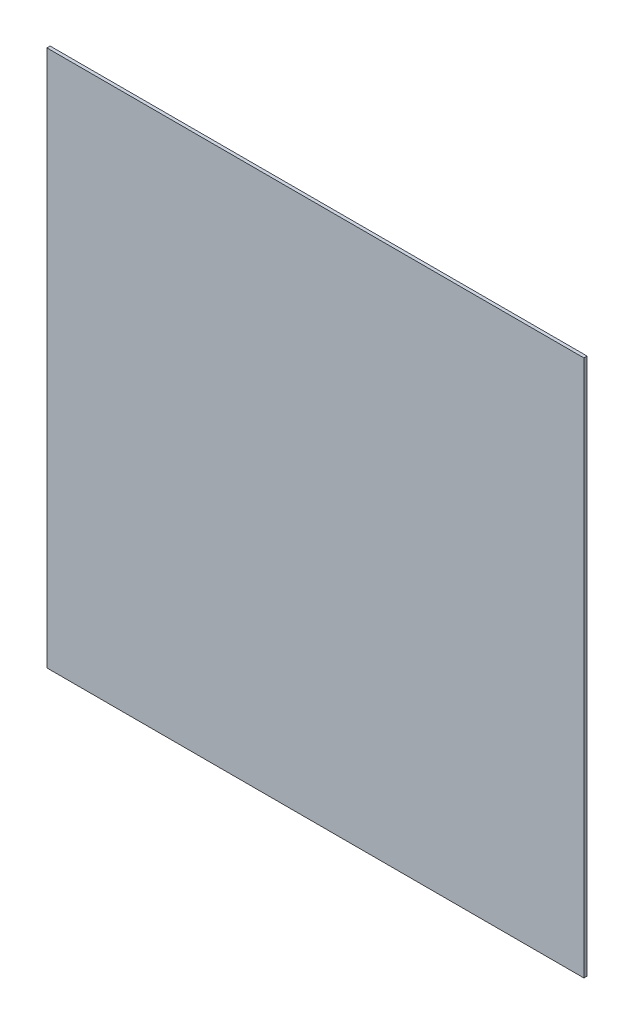
from build123d import *

# Parameters (mm, degrees)
SKETCH1_W           = 30
SKETCH1_H           = 30
BOSS_EXTRUDE1_DEPTH = 0.18


with BuildPart() as part:
    # Sketch1 → Boss-Extrude1 (new body)
    with BuildSketch(Plane.XY):
        Rectangle(SKETCH1_W, SKETCH1_H)
    extrude(amount=BOSS_EXTRUDE1_DEPTH)


solid = part.part
